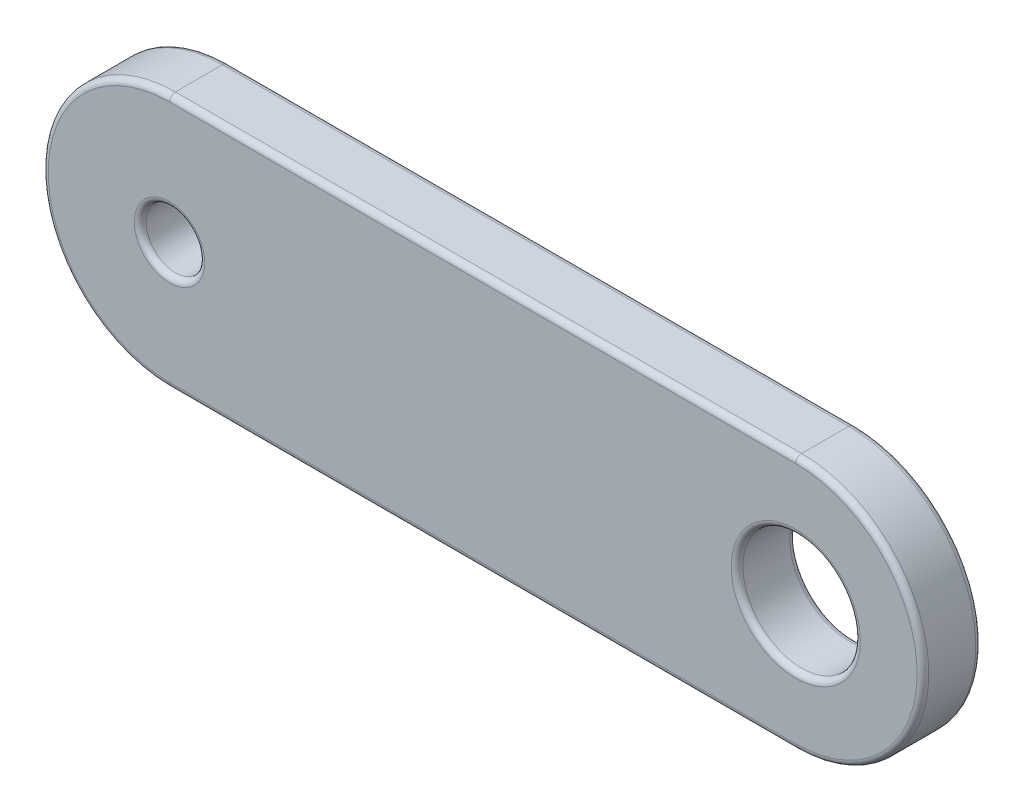
from build123d import *

# Parameters (mm, degrees)
SKETCH_1_R      = 0.75
SKETCH_1_R_2    = 1.5
EXTRUDE_1_DEPTH = 0.75
FILLET_1_R      = 0.15


with BuildPart() as part:
    # 草图1 → 凸台-拉伸1 (new, symmetric)
    with BuildSketch(Plane.XY):
        with BuildLine():
            Line((-8, 3.25), (8, 3.25))
            ThreePointArc((8, 3.25), (11.25, 0), (8, -3.25))
            Line((8, -3.25), (-8, -3.25))
            ThreePointArc((-8, -3.25), (-11.25, 0), (-8, 3.25))
        make_face()
        with Locations((-8, 0)):
            Circle(SKETCH_1_R, mode=Mode.SUBTRACT)
        with Locations((8, 0)):
            Circle(SKETCH_1_R_2, mode=Mode.SUBTRACT)
    extrude(amount=EXTRUDE_1_DEPTH, both=True)

    # 圆角1
    fillet_1_edges = [part.edges().sort_by_distance(p)[0] for p in [
        (-8.75, 0, -0.75),
        (-8.75, 0, 0.75),
        (11.25, 0, 0.75),
        (6.5, 0, -0.75),
        (6.5, 0, 0.75),
        (0, 3.25, 0.75),
        (-11.25, 0, 0.75),
        (0, 3.25, -0.75),
        (11.25, 0, -0.75),
        (0, -3.25, -0.75),
        (-11.25, 0, -0.75),
        (0, -3.25, 0.75),
    ]]
    fillet(fillet_1_edges, radius=FILLET_1_R)


solid = part.part
